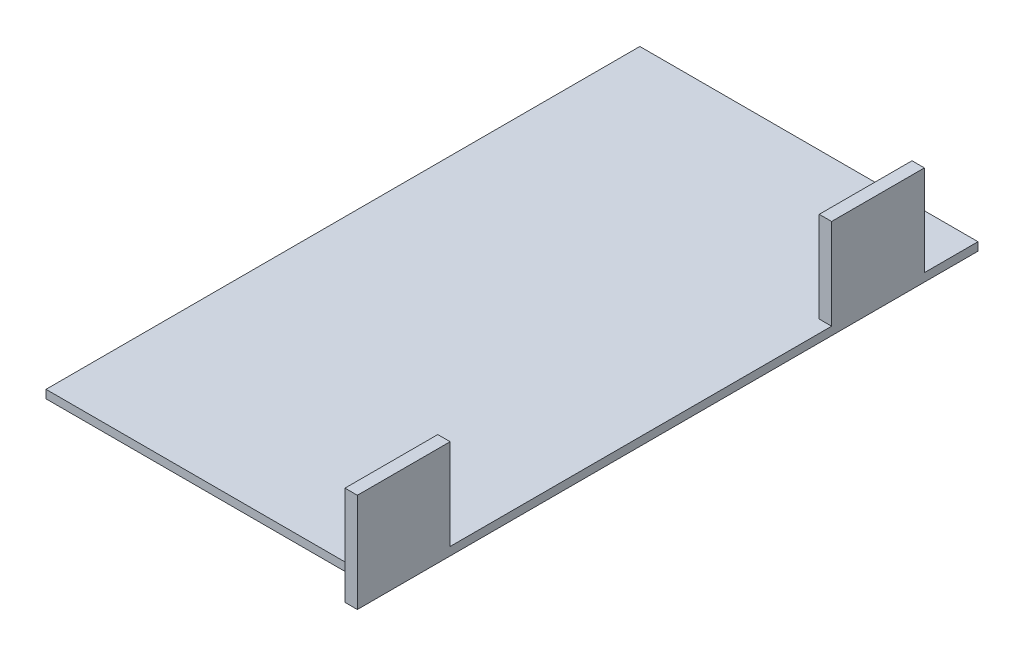
from build123d import *

# Parameters (mm, degrees)
CROQUIS1_W              = 82
CROQUIS1_H              = 144
SALIENTE_EXTRUIR1_DEPTH = 2
CROQUIS2_W              = 3
CROQUIS2_H              = 22.5
SALIENTE_EXTRUIR4_DEPTH = 24


with BuildPart() as part:
    # Croquis1 → Saliente-Extruir1 (new body)
    with BuildSketch(Plane(origin=(0, 0, 0), x_dir=(1, 0, 0), z_dir=(0, 1, 0))):
        Rectangle(CROQUIS1_W, CROQUIS1_H)
    extrude(amount=SALIENTE_EXTRUIR1_DEPTH)

    # Croquis2 → Saliente-Extruir4 (add)
    with BuildSketch(Plane.XZ):
        with Locations((39.5, 67.25)):
            Rectangle(CROQUIS2_W, CROQUIS2_H)
        with Locations((39.5, -47.75)):
            Rectangle(CROQUIS2_W, CROQUIS2_H)
    extrude(amount=-SALIENTE_EXTRUIR4_DEPTH)


solid = part.part
